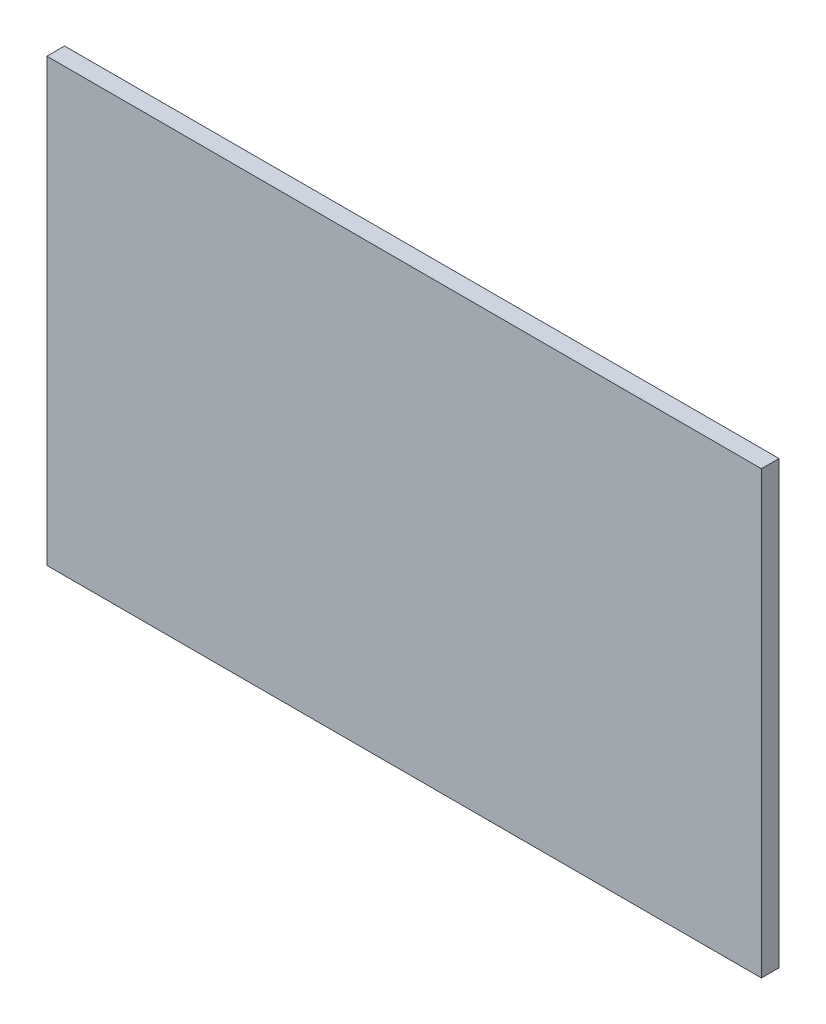
from build123d import *

# Parameters (mm, degrees)
SKETCH_1_W      = 648
SKETCH_1_H      = 400
EXTRUDE_1_DEPTH = 16


with BuildPart() as part:
    # Эскиз1 → Бобышка-Вытянуть1 (new body)
    with BuildSketch(Plane.XY):
        with Locations((267.051441532, -161.929466357)):
            Rectangle(SKETCH_1_W, SKETCH_1_H)
    extrude(amount=EXTRUDE_1_DEPTH)


solid = part.part
